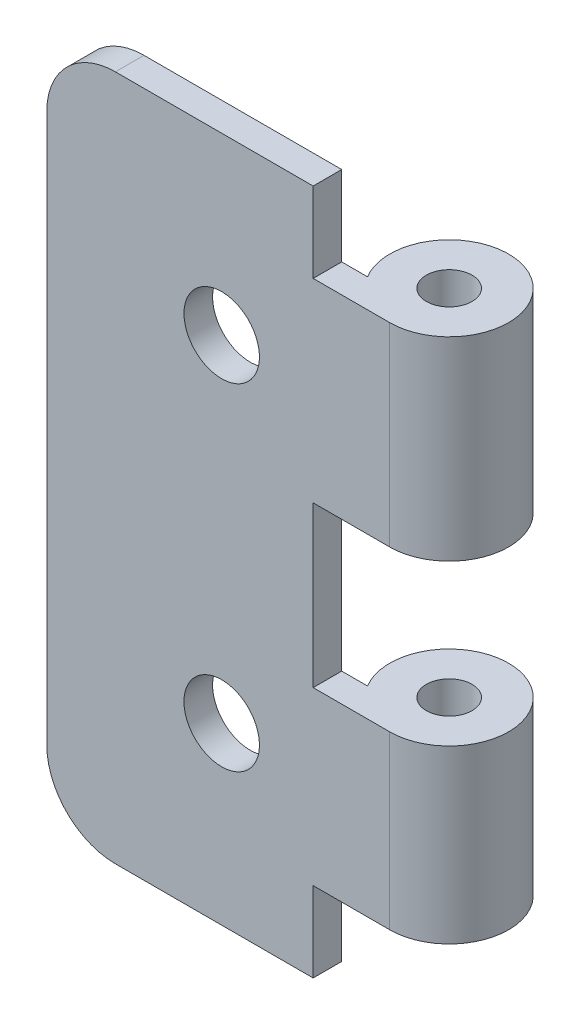
from build123d import *

# Parameters (mm, degrees)
BOSS_EXTRUDE1_DEPTH = 76.2
SKETCH2_R           = 4.191
CUT_EXTRUDE1_DEPTH  = 50.8
CUT_EXTRUDE2_DEPTH  = 8.89
CUT_EXTRUDE3_START  = 27.94
CUT_EXTRUDE3_DEPTH  = 17.78
SKETCH3_R           = 2.54
CUT_EXTRUDE4_DEPTH  = 90.327145258
CUT_EXTRUDE5_START  = 67.31
CUT_EXTRUDE5_DEPTH  = 8.89
FILLET1_R           = 7.62
FILLET2_R           = 7.62


with BuildPart() as part:
    # Sketch1 → Boss-Extrude1 (new body)
    with BuildSketch(Plane(origin=(0, 0, 0), x_dir=(1, 0, 0), z_dir=(0, 1, 0))):
        with BuildLine():
            Line((0, 0), (38.1, 0))
            ThreePointArc((38.1, 0), (41.337877391, 12.35977675), (32.455996545, 3.175))
            Line((32.455996545, 3.175), (0, 3.175))
            Line((0, 3.175), (0, 0))
        make_face()
    extrude(amount=BOSS_EXTRUDE1_DEPTH)

    # Sketch2 → Cut-Extrude1 (cut)
    with BuildSketch(Plane(origin=(0, 0, -3.175), x_dir=(-1, 0, 0), z_dir=(0, 0, -1))):
        with Locations((-19.431, 56.769)):
            Circle(SKETCH2_R)
        with Locations((-19.431, 19.431)):
            Circle(SKETCH2_R)
    extrude(amount=-CUT_EXTRUDE1_DEPTH, mode=Mode.SUBTRACT)

    # Sketch1<3> → Cut-Extrude2 (cut)
    with BuildSketch(Plane(origin=(0, 0, 0), x_dir=(1, 0, 0), z_dir=(0, 1, 0))):
        with BuildLine():
            Line((32.455996545, 3.175), (29.591, 3.175))
            Line((29.591, 3.175), (29.591, 0))
            Line((29.591, 0), (38.1, 0))
            ThreePointArc((38.1, 0), (41.337877391, 12.35977675), (32.455996545, 3.175))
        make_face()
    extrude(amount=CUT_EXTRUDE2_DEPTH, mode=Mode.SUBTRACT)

    # Sketch1<5> → Cut-Extrude3 (cut)
    with BuildSketch(Plane(origin=(0, 0, 0), x_dir=(1, 0, 0), z_dir=(0, 1, 0)).offset(CUT_EXTRUDE3_START)):
        with BuildLine():
            Line((32.455996545, 3.175), (29.591, 3.175))
            Line((29.591, 3.175), (29.591, 0))
            Line((29.591, 0), (38.1, 0))
            ThreePointArc((38.1, 0), (41.337877391, 12.35977675), (32.455996545, 3.175))
        make_face()
    extrude(amount=CUT_EXTRUDE3_DEPTH, mode=Mode.SUBTRACT)

    # Sketch3 → Cut-Extrude4 (cut, through all)
    with BuildSketch(Plane(origin=(0, 76.2, 0), x_dir=(1, 0, 0), z_dir=(0, 1, 0))):
        with Locations((38.1, 6.604)):
            Circle(SKETCH3_R)
    extrude(amount=-CUT_EXTRUDE4_DEPTH, mode=Mode.SUBTRACT)

    # Sketch1<6> → Cut-Extrude5 (cut)
    with BuildSketch(Plane(origin=(0, 0, 0), x_dir=(1, 0, 0), z_dir=(0, 1, 0)).offset(CUT_EXTRUDE5_START)):
        with BuildLine():
            Line((32.455996545, 3.175), (29.591, 3.175))
            Line((29.591, 3.175), (29.591, 0))
            Line((29.591, 0), (38.1, 0))
            ThreePointArc((38.1, 0), (41.337877391, 12.35977675), (32.455996545, 3.175))
        make_face()
    extrude(amount=CUT_EXTRUDE5_DEPTH, mode=Mode.SUBTRACT)

    # Fillet1
    fillet1_edges = [part.edges().sort_by_distance(p)[0] for p in [
        (0, 0, -1.5875),
    ]]
    fillet(fillet1_edges, radius=FILLET1_R)

    # Fillet2
    fillet2_edges = [part.edges().sort_by_distance(p)[0] for p in [
        (0, 76.2, -1.5875),
    ]]
    fillet(fillet2_edges, radius=FILLET2_R)


solid = part.part
